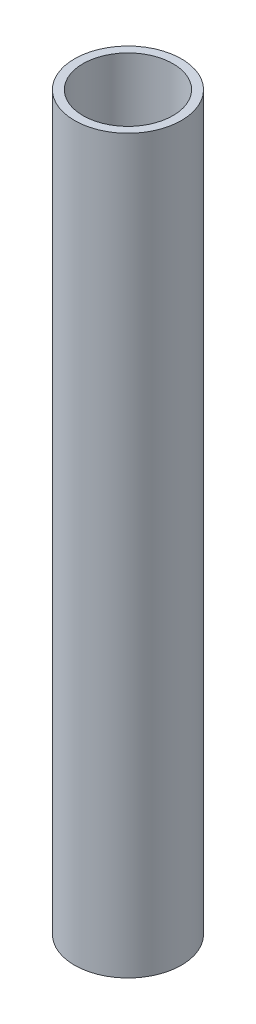
from build123d import *

# Parameters (mm, degrees)
SKETCH1_R           = 9.5
SKETCH1_R_2         = 8
BOSS_EXTRUDE1_DEPTH = 130


with BuildPart() as part:
    # Sketch1 → Boss-Extrude1 (new body)
    with BuildSketch(Plane(origin=(0, 0, 0), x_dir=(1, 0, 0), z_dir=(0, 1, 0))):
        Circle(SKETCH1_R)
        Circle(SKETCH1_R_2, mode=Mode.SUBTRACT)
    extrude(amount=BOSS_EXTRUDE1_DEPTH)


solid = part.part
